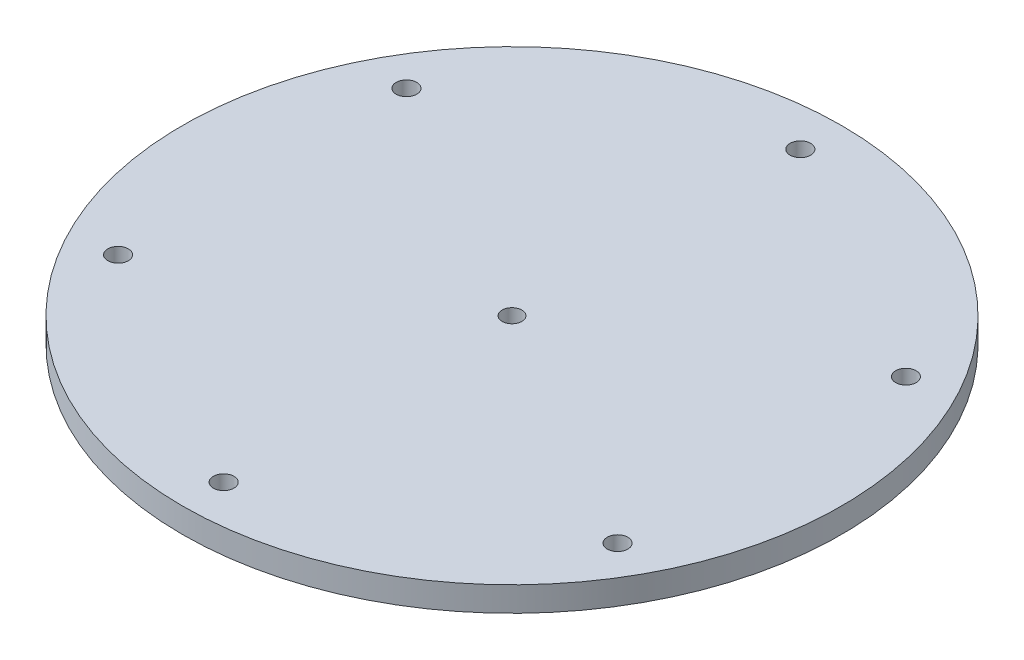
from build123d import *

# Parameters (mm, degrees)
SKETCH1_R           = 80
SKETCH1_R_2         = 2.5
SKETCH1_R_3         = 2.4
BOSS_EXTRUDE1_DEPTH = 6


with BuildPart() as part:
    # Sketch1 → Boss-Extrude1 (new body)
    with BuildSketch(Plane(origin=(0, 0, 0), x_dir=(1, 0, 0), z_dir=(0, 1, 0))):
        with Locations(Location((0, 0, 0), (0, 0, 270))):
            Circle(SKETCH1_R)
        with Locations(Location((0, 70, 0), (0, 0, 270))):
            Circle(SKETCH1_R_2, mode=Mode.SUBTRACT)
        with Locations(Location((60.621778265, 35, 0), (0, 0, 270))):
            Circle(SKETCH1_R_2, mode=Mode.SUBTRACT)
        with Locations(Location((60.621778265, -35, 0), (0, 0, 270))):
            Circle(SKETCH1_R_2, mode=Mode.SUBTRACT)
        with Locations(Location((0, -70, 0), (0, 0, 270))):
            Circle(SKETCH1_R_2, mode=Mode.SUBTRACT)
        with Locations(Location((-60.621778265, -35, 0), (0, 0, 270))):
            Circle(SKETCH1_R_2, mode=Mode.SUBTRACT)
        with Locations(Location((-60.621778265, 35, 0), (0, 0, 270))):
            Circle(SKETCH1_R_2, mode=Mode.SUBTRACT)
        with Locations(Location((0, 0, 0), (0, 0, 270))):
            Circle(SKETCH1_R_3, mode=Mode.SUBTRACT)
    extrude(amount=BOSS_EXTRUDE1_DEPTH)


solid = part.part
